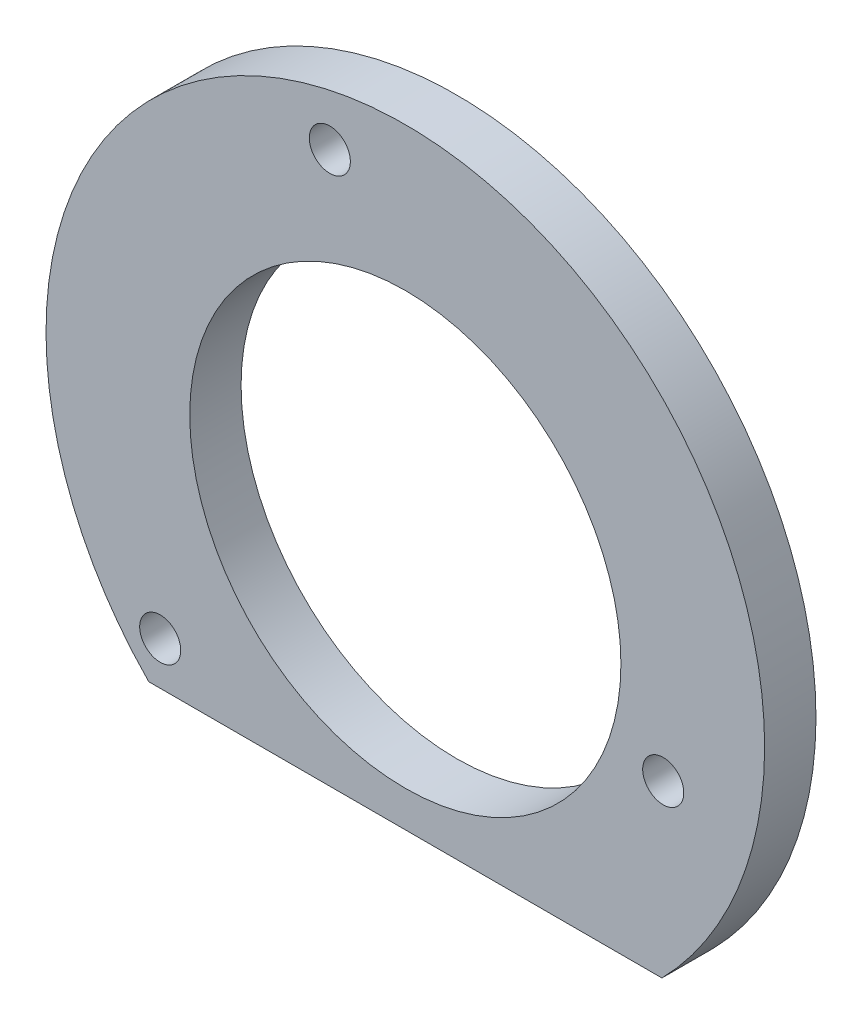
from build123d import *

# Parameters (mm, degrees)
SKETCH1_R           = 35.56
BOSS_EXTRUDE1_DEPTH = 5.08
CUT_EXTRUDE1_DEPTH  = 51.545361805
SKETCH7_R           = 2.032
CUT_EXTRUDE2_DEPTH  = 51.545361805
SKETCH8_R           = 21.336
CUT_EXTRUDE3_DEPTH  = 51.545361805


with BuildPart() as part:
    # Sketch1 → Boss-Extrude1 (new body)
    with BuildSketch(Plane.XY):
        Circle(SKETCH1_R)
    extrude(amount=BOSS_EXTRUDE1_DEPTH)

    # Sketch2 → Cut-Extrude1 (cut, through all)
    with BuildSketch(Plane.XY.offset(5.08)):
        Polygon((0, -35.56), (-36.256055522, -35.56), (-36.256055522, -24.892), (33.75035888, -24.892), (33.75035888, -35.56), align=None)
    extrude(amount=-CUT_EXTRUDE1_DEPTH, mode=Mode.SUBTRACT)

    # Sketch7 → Cut-Extrude2 (cut, through all)
    with BuildSketch(Plane.XY.offset(5.08)):
        with Locations((-24.261099887, -20.626476503)):
            Circle(SKETCH7_R)
        with Locations((-7.471969114, 29.665523497)):
            Circle(SKETCH7_R)
        with Locations((25.522900113, -7.952823738)):
            Circle(SKETCH7_R)
    extrude(amount=-CUT_EXTRUDE2_DEPTH, mode=Mode.SUBTRACT)

    # Sketch8 → Cut-Extrude3 (cut, through all)
    with BuildSketch(Plane(origin=(0, 0, 0), x_dir=(-1, 0, 0), z_dir=(0, 0, -1))):
        Circle(SKETCH8_R)
    extrude(amount=-CUT_EXTRUDE3_DEPTH, mode=Mode.SUBTRACT)


solid = part.part
